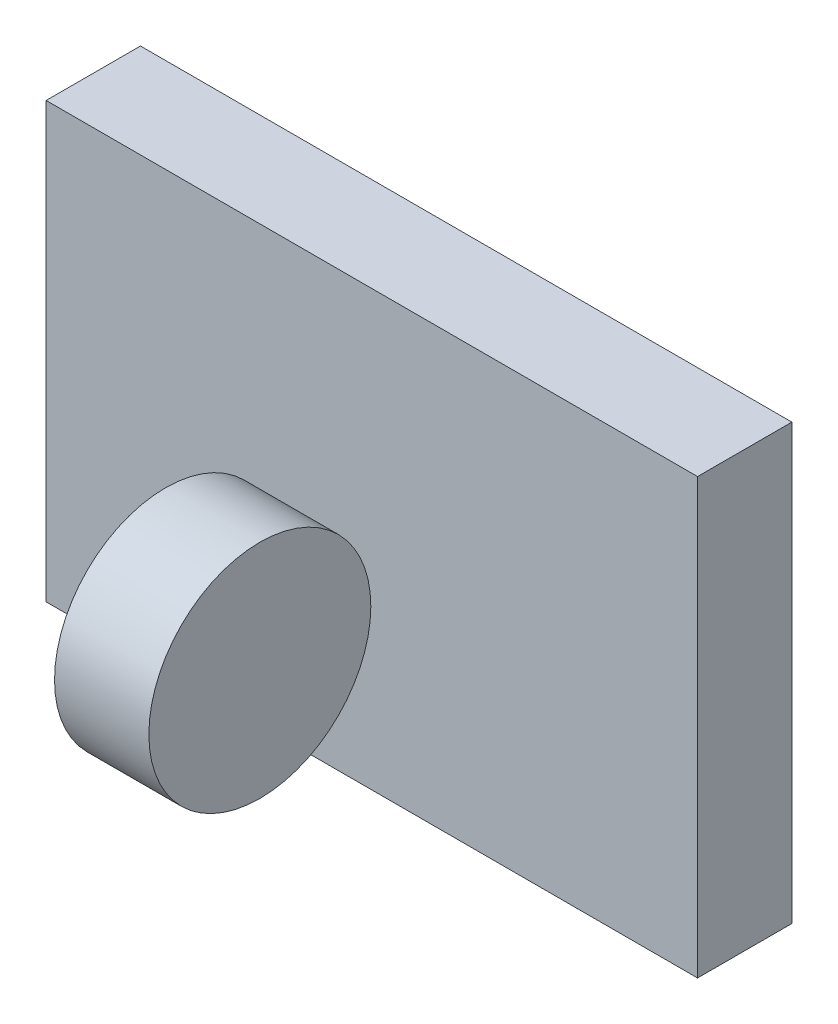
from build123d import *

# Parameters (mm, degrees)
SKETCH_1_W      = 69.064774026
SKETCH_1_H      = 46.043182684
EXTRUDE_1_DEPTH = 10
SKETCH_2_R      = 11.767350743
EXTRUDE_3_DEPTH = 10


with BuildPart() as part:
    # Эскиз1 → Бобышка-Вытянуть1 (new body)
    with BuildSketch(Plane.XY):
        with Locations((2.12506997, -1.770891642)):
            Rectangle(SKETCH_1_W, SKETCH_1_H)
    extrude(amount=-EXTRUDE_1_DEPTH)


with BuildPart() as body_2:
    # Эскиз2 → Бобышка-Вытянуть3 (new body)
    with BuildSketch(Plane(origin=(0, 0, 0), x_dir=(0, 0, -1), z_dir=(1, 0, 0))):
        with Locations((-19.75002894, 0)):
            Circle(SKETCH_2_R)
    extrude(amount=EXTRUDE_3_DEPTH)


solid = Compound([part.part, body_2.part])
